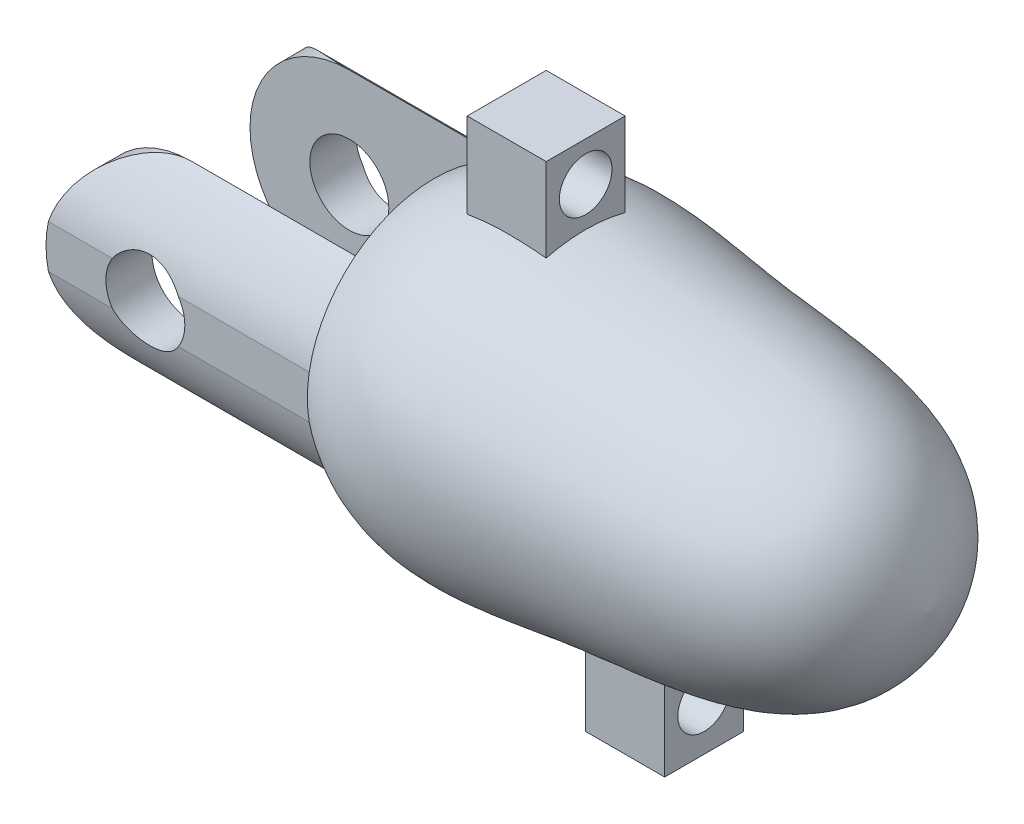
from build123d import *

# Parameters (mm, degrees)
SKETCH2_W               = 19
SKETCH2_H               = 20
BOSS_EXTRUDE1_DEPTH     = 20
SKETCH3_R               = 15
SKETCH3_R_2             = 9.642090149
CUT_EXTRUDE1_DEPTH      = 42.372377867
CUT_EXTRUDE2_DEPTH      = 42.267785166
CUT_EXTRUDE2_DEPTH_BACK = 42.267785166
SKETCH4_W               = 20
SKETCH4_H               = 12
CUT_EXTRUDE3_DEPTH      = 44.418151428
CUT_EXTRUDE3_DEPTH_BACK = 44.418151428
SKETCH7_R               = 3
CUT_EXTRUDE4_DEPTH      = 45.995713719
SKETCH8_W               = 6
SKETCH8_H               = 6
BOSS_EXTRUDE3_DEPTH     = 18
SKETCH9_R               = 2
CUT_EXTRUDE5_DEPTH      = 16
SKETCH10_W              = 6
SKETCH10_H              = 6
BOSS_EXTRUDE4_DEPTH     = 18
SKETCH11_R              = 2
CUT_EXTRUDE6_DEPTH      = 39.271928202
SCALE1_SCALE            = 0.75


with BuildPart() as part:
    # Sketch1 → Revolve1 (revolve)
    with BuildSketch(Plane.XY):
        with BuildLine():
            Line((-17.503938211, 9.642090149), (-17.503938211, 0))
            Line((-17.503938211, 0), (20.115058741, 0))
            add(Edge.make_bspline(
                [(-17.503938211, 9.642090149), (-12.037965172, 13.468024809), (1.720669261, 9.986942396), (18.674857326, 10.7604322), (20.115058741, 0)],
                knots=[0, 0, 0, 0, 0.417251545, 1, 1, 1, 1], degree=3))
        make_face()
    revolve(axis=Axis((-34.275157211, 0, 0), (1, 0, 0)))

    # Sketch2 → Boss-Extrude1 (add)
    with BuildSketch(Plane.ZY.offset(17.503938211)):
        Rectangle(SKETCH2_W, SKETCH2_H)
    extrude(amount=BOSS_EXTRUDE1_DEPTH)

    # Sketch3 → Cut-Extrude1 (cut, through all)
    with BuildSketch(Plane.ZY.offset(17.503938211)):
        Circle(SKETCH3_R)
        Circle(SKETCH3_R_2, mode=Mode.SUBTRACT)
    extrude(amount=CUT_EXTRUDE1_DEPTH, mode=Mode.SUBTRACT)

    # Sketch4 → Cut-Extrude2 (cut, two sides: drawn at the far end of the back side and taken through both)
    with BuildSketch(Plane(origin=(0, 0, 0), x_dir=(1, 0, 0), z_dir=(0, 1, 0)).offset(-CUT_EXTRUDE2_DEPTH_BACK)):
        with Locations((-27.503938211, 0)):
            Rectangle(SKETCH4_W, SKETCH4_H)
    extrude(amount=CUT_EXTRUDE2_DEPTH + CUT_EXTRUDE2_DEPTH_BACK, mode=Mode.SUBTRACT)

    # Sketch6 → Cut-Extrude3 (cut, two sides: drawn at the far end of the back side and taken through both)
    with BuildSketch(Plane.XY.offset(-6).offset(-CUT_EXTRUDE3_DEPTH_BACK)):
        with BuildLine():
            Line((-37.503938211, -7.547840913), (-29.956097298, -7.547840913))
            ThreePointArc((-29.956097298, -7.547840913), (-35.293226791, -5.337129493), (-37.503938211, 0))
            Line((-37.503938211, 0), (-37.503938211, -7.547840913))
        make_face()
        with BuildLine():
            Line((-37.503938211, 7.547840913), (-37.503938211, 0))
            ThreePointArc((-37.503938211, 0), (-35.293226791, 5.337129493), (-29.956097298, 7.547840913))
            Line((-29.956097298, 7.547840913), (-37.503938211, 7.547840913))
        make_face()
    extrude(amount=CUT_EXTRUDE3_DEPTH + CUT_EXTRUDE3_DEPTH_BACK, mode=Mode.SUBTRACT)

    # Sketch7 → Cut-Extrude4 (cut, through all)
    with BuildSketch(Plane.XY.offset(9.5)):
        with Locations((-29.956097298, 0)):
            Circle(SKETCH7_R)
    extrude(amount=-CUT_EXTRUDE4_DEPTH, mode=Mode.SUBTRACT)

    # Sketch8 → Boss-Extrude3 (add)
    with BuildSketch(Plane(origin=(0, 0, 0), x_dir=(1, 0, 0), z_dir=(0, 1, 0))):
        Rectangle(SKETCH8_W, SKETCH8_H)
    extrude(amount=-BOSS_EXTRUDE3_DEPTH)

    # Sketch9 → Cut-Extrude5 (cut)
    with BuildSketch(Plane(origin=(3, 0, 0), x_dir=(0, 0, -1), z_dir=(1, 0, 0))):
        with Locations((0, -14.50236021)):
            Circle(SKETCH9_R)
    extrude(amount=-CUT_EXTRUDE5_DEPTH, mode=Mode.SUBTRACT)

    # Sketch10 → Boss-Extrude4 (add)
    with BuildSketch(Plane(origin=(0, 0, 0), x_dir=(1, 0, 0), z_dir=(0, 1, 0))):
        with Locations((-9, 0)):
            Rectangle(SKETCH10_W, SKETCH10_H)
    extrude(amount=BOSS_EXTRUDE4_DEPTH)

    # Sketch11 → Cut-Extrude6 (cut, through all)
    with BuildSketch(Plane(origin=(-6, 0, 0), x_dir=(0, 0, -1), z_dir=(1, 0, 0))):
        with Locations((0, 15.01416918)):
            Circle(SKETCH11_R)
    extrude(amount=-CUT_EXTRUDE6_DEPTH, mode=Mode.SUBTRACT)


with BuildPart() as part_1:
    # Scale1: scaled about (-3.660408947, -0.025369867, 3.84e-07)
    add(part.part.scale(SCALE1_SCALE).moved(Location((-0.915102237, -0.006342467, 9.6e-08))))


solid = part_1.part
